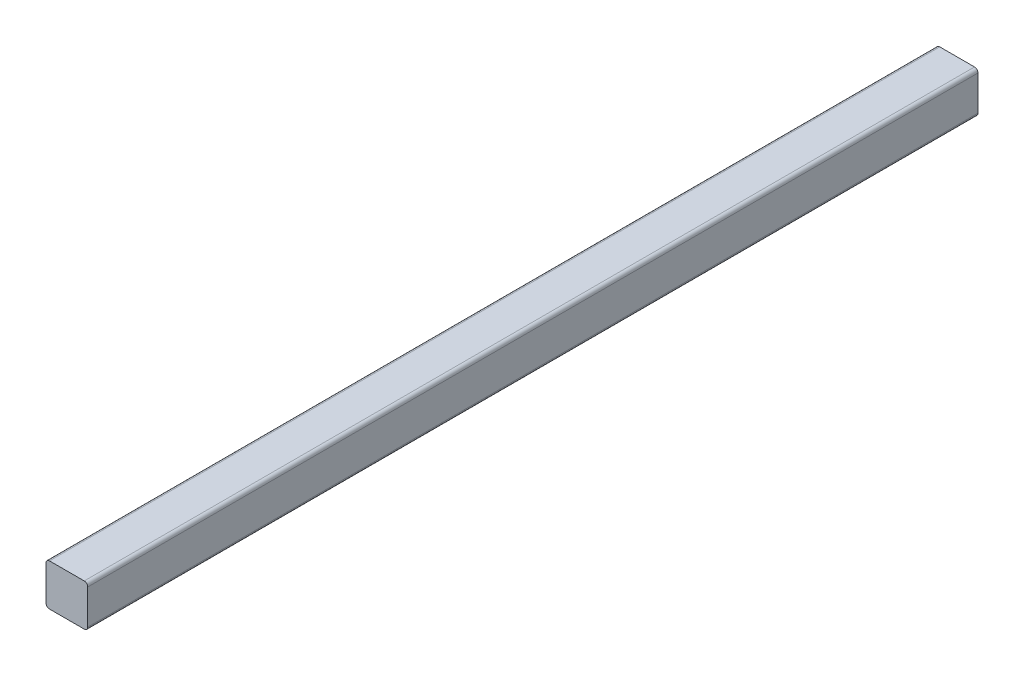
from build123d import *

# Parameters (mm, degrees)
SKETCH1_W           = 38.1
SKETCH1_H           = 38.1
BOSS_EXTRUDE1_DEPTH = 812.8
FILLET1_R           = 3.175


with BuildPart() as part:
    # Sketch1 → Boss-Extrude1 (new body)
    with BuildSketch(Plane.XY):
        Rectangle(SKETCH1_W, SKETCH1_H)
    extrude(amount=BOSS_EXTRUDE1_DEPTH)

    # Fillet1
    fillet1_edges = [part.edges().sort_by_distance(p)[0] for p in [
        (19.05, -19.05, 406.4),
        (-19.05, -19.05, 406.4),
        (-19.05, 19.05, 406.4),
        (19.05, 19.05, 406.4),
    ]]
    fillet(fillet1_edges, radius=FILLET1_R)


solid = part.part
